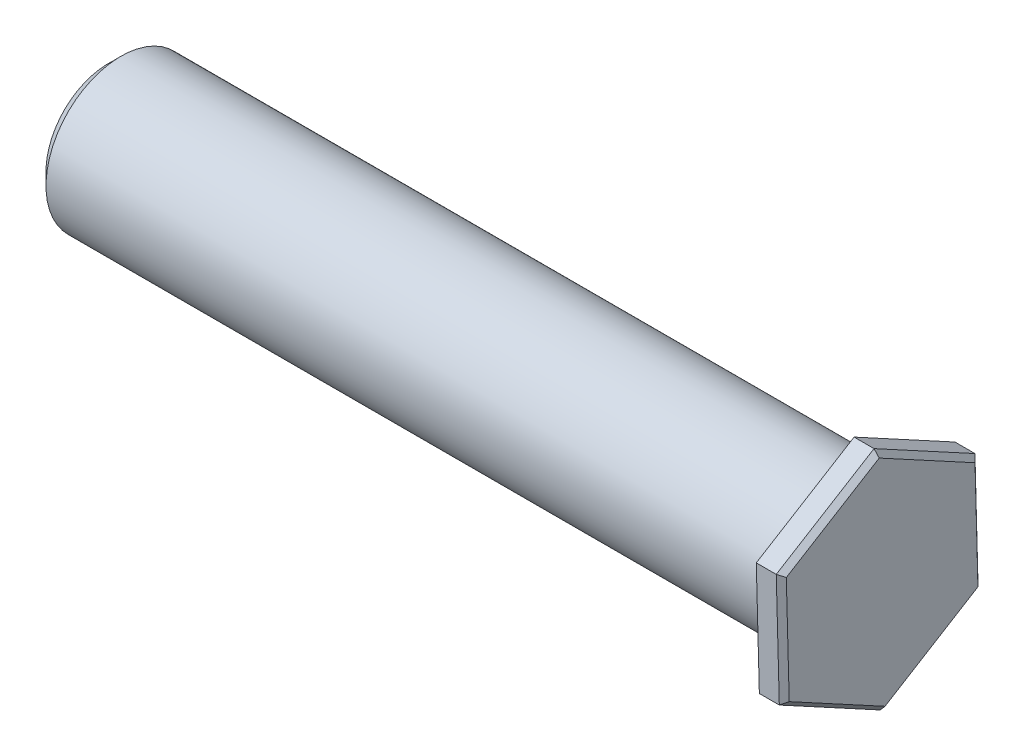
from build123d import *

# Parameters (mm, degrees)
SKETCH1_R           = 15
BOSS_EXTRUDE1_DEPTH = 150
BOSS_EXTRUDE2_DEPTH = 5
CHAMFER1_SIZE       = 1
CHAMFER3_SIZE       = 2.5


with BuildPart() as part:
    # Sketch1 → Boss-Extrude1 (new body)
    with BuildSketch(Plane(origin=(0, 0, 0), x_dir=(0, 0, -1), z_dir=(1, 0, 0))):
        Circle(SKETCH1_R)
    extrude(amount=BOSS_EXTRUDE1_DEPTH)

    # Sketch2 → Boss-Extrude2 (add)
    with BuildSketch(Plane(origin=(150, 0, 0), x_dir=(0, 0, -1), z_dir=(1, 0, 0))):
        Polygon((-20.208539493, 10.958674909), (-19.594760609, -12.02177112), (0.613778884, -22.980446029), (20.208539493, -10.958674909), (19.594760609, 12.02177112), (-0.613778884, 22.980446029), align=None)
    extrude(amount=BOSS_EXTRUDE2_DEPTH)

    # Chamfer1
    chamfer1_edges = [part.edges().sort_by_distance(p)[0] for p in [
        (155, 16.969560469, 10.411159188),
        (155, -0.531548105, 19.901650051),
        (155, -17.501108574, 9.490490863),
        (155, -16.969560469, -10.411159188),
        (155, 0.531548105, -19.901650051),
        (155, 17.501108574, -9.490490863),
    ]]
    chamfer(chamfer1_edges, length=CHAMFER1_SIZE)

    # Chamfer3
    chamfer3_edges = [part.edges().sort_by_distance(p)[0] for p in [
        (0, 0, 15),
    ]]
    chamfer(chamfer3_edges, length=CHAMFER3_SIZE)


solid = part.part
